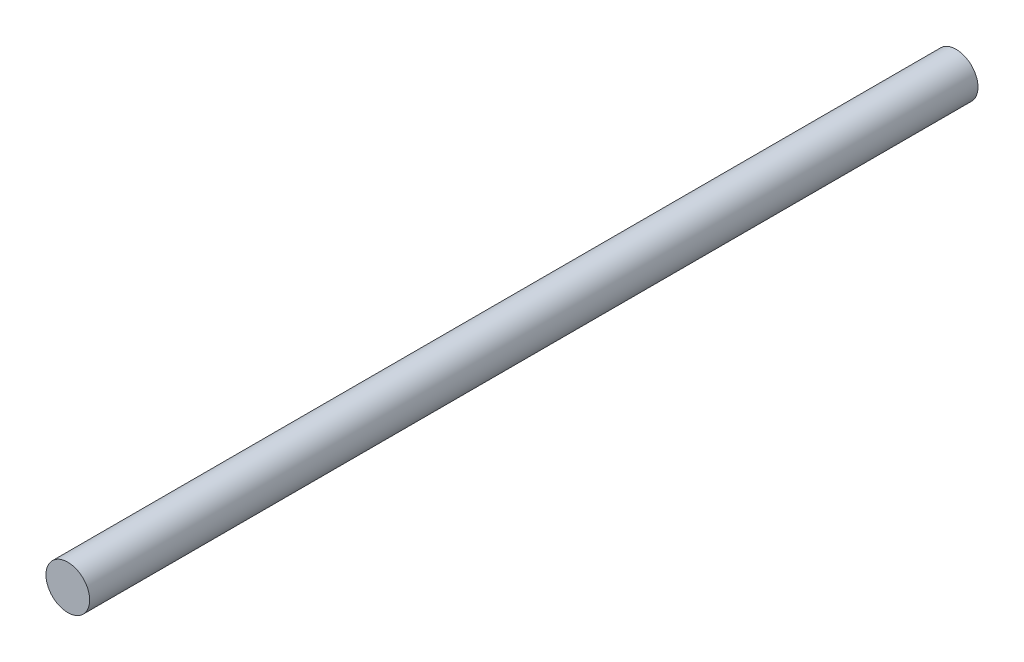
from build123d import *

# Parameters (mm, degrees)
SKETCH_1_R      = 1.65
EXTRUDE_1_DEPTH = 67.05


with BuildPart() as part:
    # 草图1 → 凸台-拉伸1 (new body)
    with BuildSketch(Plane.XY):
        Circle(SKETCH_1_R)
    extrude(amount=EXTRUDE_1_DEPTH)


solid = part.part
